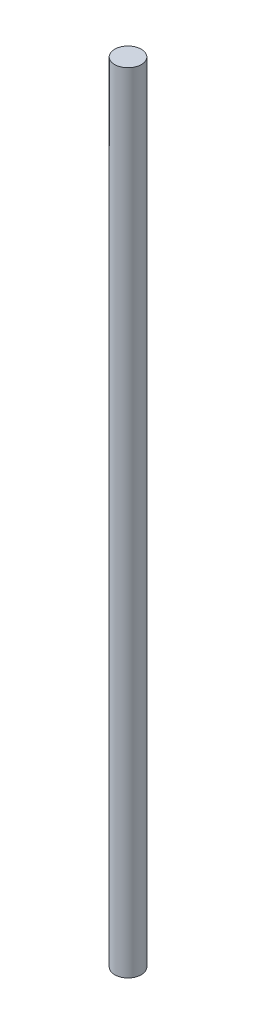
from build123d import *

# Parameters (mm, degrees)
SKETCH1_W = 1.3
SKETCH1_H = 77


with BuildPart() as part:
    # Sketch1 → Tendon (revolve)
    with BuildSketch(Plane.XY, mode=Mode.PRIVATE) as tendon_sk:
        with Locations((0.65, -38.5)):
            Rectangle(SKETCH1_W, SKETCH1_H)
    revolve(tendon_sk.sketch.rotate(Axis((0, -81, 0), (0, 1, 0)), 90), axis=Axis((0, -81, 0), (0, 1, 0)))


solid = part.part
